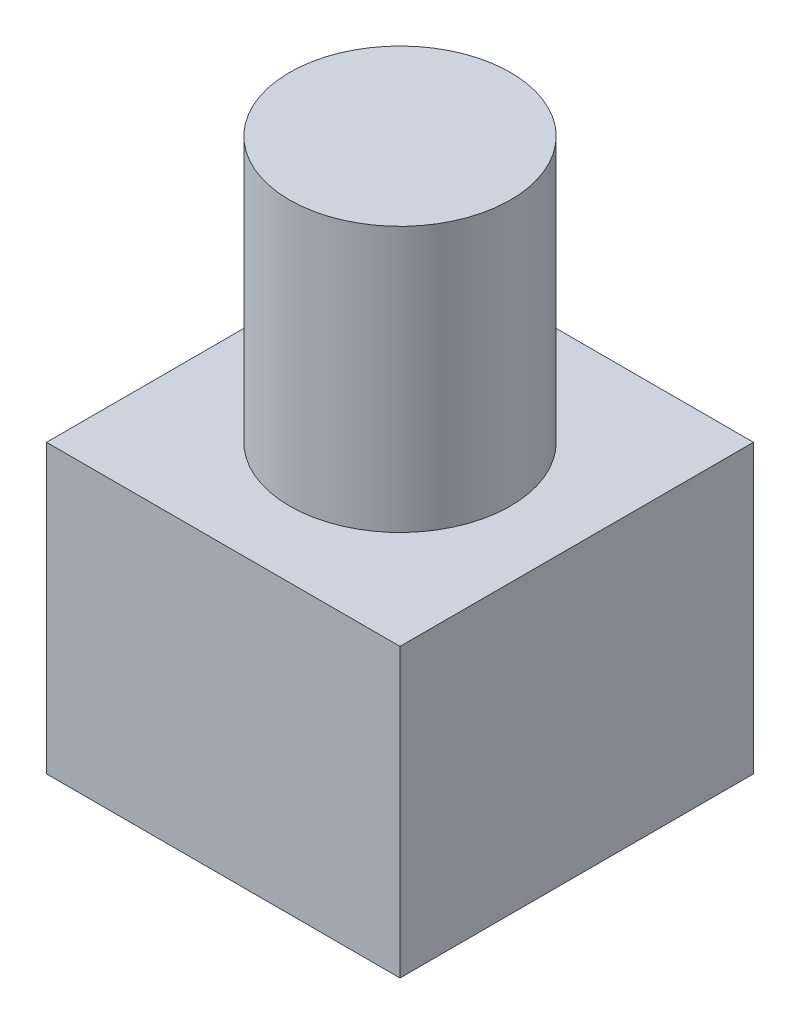
from build123d import *

# Parameters (mm, degrees)
SZKIC1_W                    = 8
SZKIC1_H                    = 8
DODANIE_WYCI_GNI_CIE1_DEPTH = 6.5
SZKIC2_R                    = 2.5
DODANIE_WYCI_GNI_CIE2_DEPTH = 6


with BuildPart() as part:
    # Szkic1 → Dodanie-wyciągnięcie1 (new body)
    with BuildSketch(Plane(origin=(0, 0, 0), x_dir=(1, 0, 0), z_dir=(0, 1, 0))):
        Rectangle(SZKIC1_W, SZKIC1_H)
    extrude(amount=DODANIE_WYCI_GNI_CIE1_DEPTH)

    # Szkic2 → Dodanie-wyciągnięcie2 (add)
    with BuildSketch(Plane(origin=(0, 6.5, 0), x_dir=(1, 0, 0), z_dir=(0, 1, 0))):
        with Locations(Location((0, 0, 0), (0, 0, 270))):
            Circle(SZKIC2_R)
    extrude(amount=DODANIE_WYCI_GNI_CIE2_DEPTH)


solid = part.part
